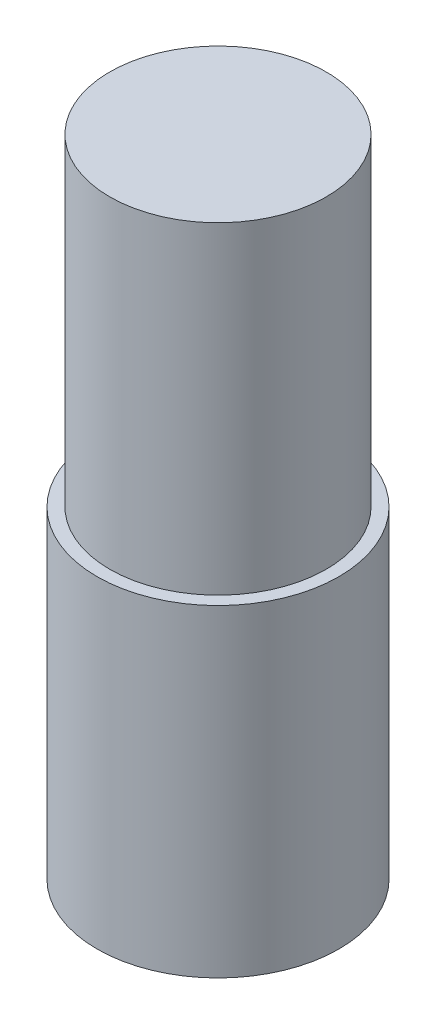
from build123d import *

# Parameters (mm, degrees)
SKETCH1_R           = 4.7625
BOSS_EXTRUDE1_DEPTH = 25.4
SKETCH2_R           = 6.303804675
SKETCH2_R_2         = 4.2625
CUT_EXTRUDE1_DEPTH  = 12.7


with BuildPart() as part:
    # Sketch1 → Boss-Extrude1 (new body)
    with BuildSketch(Plane(origin=(0, 0, 0), x_dir=(1, 0, 0), z_dir=(0, 1, 0))):
        with Locations(Location((0, 0, 0), (0, 0, 270))):
            Circle(SKETCH1_R)
    extrude(amount=BOSS_EXTRUDE1_DEPTH)

    # Sketch2 → Cut-Extrude1 (cut)
    with BuildSketch(Plane(origin=(0, 25.4, 0), x_dir=(1, 0, 0), z_dir=(0, 1, 0))):
        Circle(SKETCH2_R)
        with Locations(Location((0, 0, 0), (0, 0, 270))):
            Circle(SKETCH2_R_2, mode=Mode.SUBTRACT)
    extrude(amount=-CUT_EXTRUDE1_DEPTH, mode=Mode.SUBTRACT)


solid = part.part
